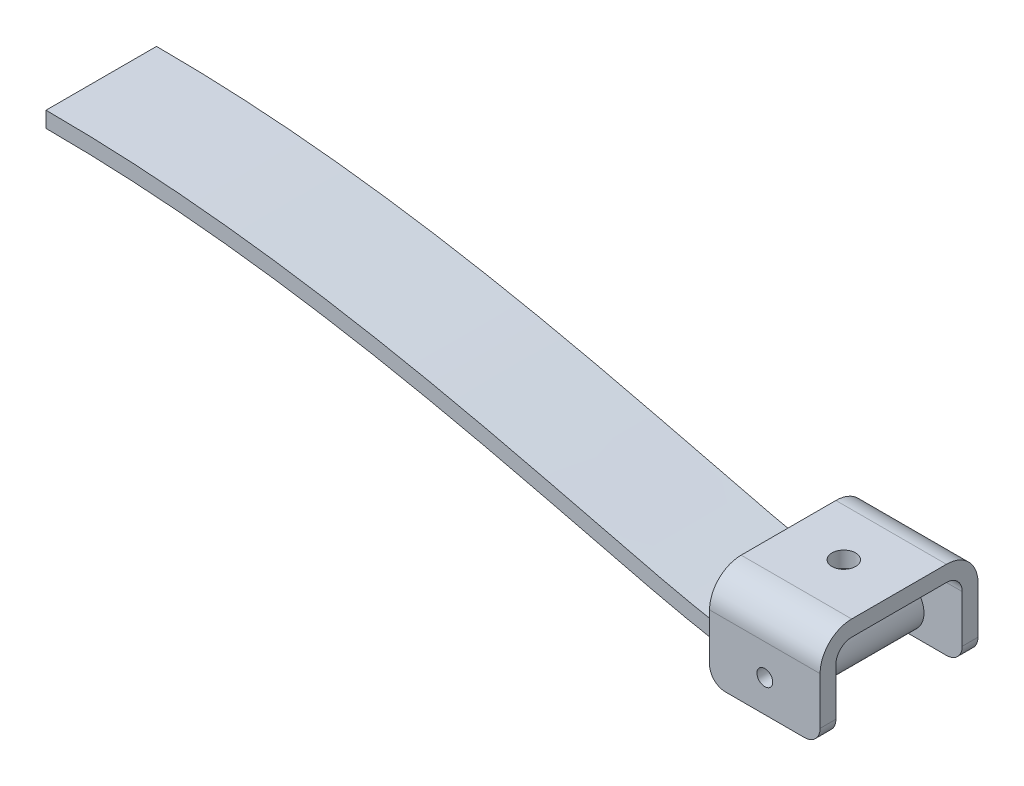
from build123d import *

# Parameters (mm, degrees)
SKETCH1_R           = 3.175
BOSS_EXTRUDE1_DEPTH = 22.225
EXTRUDE_THIN1_START = -12.7
EXTRUDE_THIN1_DEPTH = 44.45
SKETCH3_R           = 3.175
CUT_EXTRUDE1_DEPTH  = 301.023785142
FILLET1_R           = 6.35
SKETCH4_R           = 4.7625
CUT_EXTRUDE2_DEPTH  = 6.35


with BuildPart() as part:
    # Sketch1 → Boss-Extrude1 (new, symmetric)
    with BuildSketch(Plane.XY):
        with BuildLine():
            Line((-289.56, 46.228), (-289.56, 39.878))
            add(Edge.make_bspline(
                [(-289.56, 39.878), (-287.457708774, 39.878), (-283.244388722, 39.855665269), (-274.888346659, 39.72442276), (-264.530135649, 39.403232114), (-252.262197223, 38.782989217), (-236.126058345, 37.665070109), (-216.392784617, 35.763744796), (-193.474726614, 32.809033629), (-171.382325609, 29.314543407), (-143.111028194, 24.11348997), (-110.15189314, 16.930344434), (-80.779143513, 9.728615394), (-59.665965857, 4.489135204), (-45.075862357, 0.953293749), (-31.776445337, -2.055863029), (-21.796607379, -4.013222514), (-14.47880752, -5.179232924), (-9.317799197, -5.834727867), (-5.290609247, -6.180931611), (-2.210944405, -6.324967238), (-0.743079937, -6.35), (0, -6.35)],
                knots=[0, 0, 0, 0, 0.015625, 0.03125, 0.0625, 0.09375, 0.125, 0.1875, 0.25, 0.3125, 0.375, 0.5, 0.625, 0.6875, 0.75, 0.8125, 0.875, 0.90625, 0.9375, 0.96875, 0.984375, 1, 1, 1, 1], degree=3))
            Line((0, -6.35), (9.525, -6.35))
            ThreePointArc((9.525, -6.35), (15.024261314, 10.952129933), (0.544743879, 0))
            Line((0.544743879, 0), (0, 0))
            add(Edge.make_bspline(
                [(-289.56, 46.228), (-153.195442893, 46.228), (-42.127920077, 0), (0, 0)],
                knots=[0, 0, 0, 0, 1, 1, 1, 1], degree=3))
        make_face()
        with Locations((9.525, 3.175)):
            Circle(SKETCH1_R, mode=Mode.SUBTRACT)
    extrude(amount=BOSS_EXTRUDE1_DEPTH, both=True)


with BuildPart() as body_2:
    # Sketch2 → Extrude-Thin1 (new body)
    with BuildSketch(Plane(origin=(0, 0, 0), x_dir=(0, 0, -1), z_dir=(1, 0, 0)).offset(EXTRUDE_THIN1_START)):
        with BuildLine():
            Line((-32.244028337, -9.743002829), (-32.244028337, 15.656997171))
            ThreePointArc((-32.244028337, 15.656997171), (-28.524284458, 24.637253292), (-19.544028337, 28.356997171))
            Line((-19.544028337, 28.356997171), (18.555971663, 28.356997171))
            ThreePointArc((18.555971663, 28.356997171), (27.536227785, 24.637253292), (31.255971663, 15.656997171))
            Line((31.255971663, 15.656997171), (31.255971663, -9.743002829))
            Line((31.255971663, -9.743002829), (24.905971663, -9.743002829))
            Line((24.905971663, -9.743002829), (24.905971663, 15.656997171))
            ThreePointArc((24.905971663, 15.656997171), (23.046099724, 20.147125231), (18.555971663, 22.006997171))
            Line((18.555971663, 22.006997171), (-19.544028337, 22.006997171))
            ThreePointArc((-19.544028337, 22.006997171), (-24.034156397, 20.147125231), (-25.894028337, 15.656997171))
            Line((-25.894028337, 15.656997171), (-25.894028337, -9.743002829))
            Line((-25.894028337, -9.743002829), (-32.244028337, -9.743002829))
        make_face()
    extrude(amount=EXTRUDE_THIN1_DEPTH)

    # Sketch3 → Cut-Extrude1 (cut, through all)
    with BuildSketch(Plane.XY.offset(32.244028337)):
        with Locations((9.525, 3.175)):
            Circle(SKETCH3_R)
    extrude(amount=-CUT_EXTRUDE1_DEPTH, mode=Mode.SUBTRACT)

    # Fillet1
    fillet1_edges = [body_2.edges().sort_by_distance(p)[0] for p in [
        (-12.7, -9.743002829, 29.069028337),
        (-12.7, -9.743002829, -28.080971663),
        (31.75, -9.743002829, 29.069028337),
        (31.75, -9.743002829, -28.080971663),
    ]]
    fillet(fillet1_edges, radius=FILLET1_R)

    # Sketch4 → Cut-Extrude2 (cut)
    with BuildSketch(Plane(origin=(0, 28.356997171, 0), x_dir=(1, 0, 0), z_dir=(0, 1, 0))):
        with Locations(Location((9.525, -0.494028337, 0), (0, 0, 270))):
            Circle(SKETCH4_R)
    extrude(amount=-CUT_EXTRUDE2_DEPTH, mode=Mode.SUBTRACT)


solid = Compound([part.part, body_2.part])
